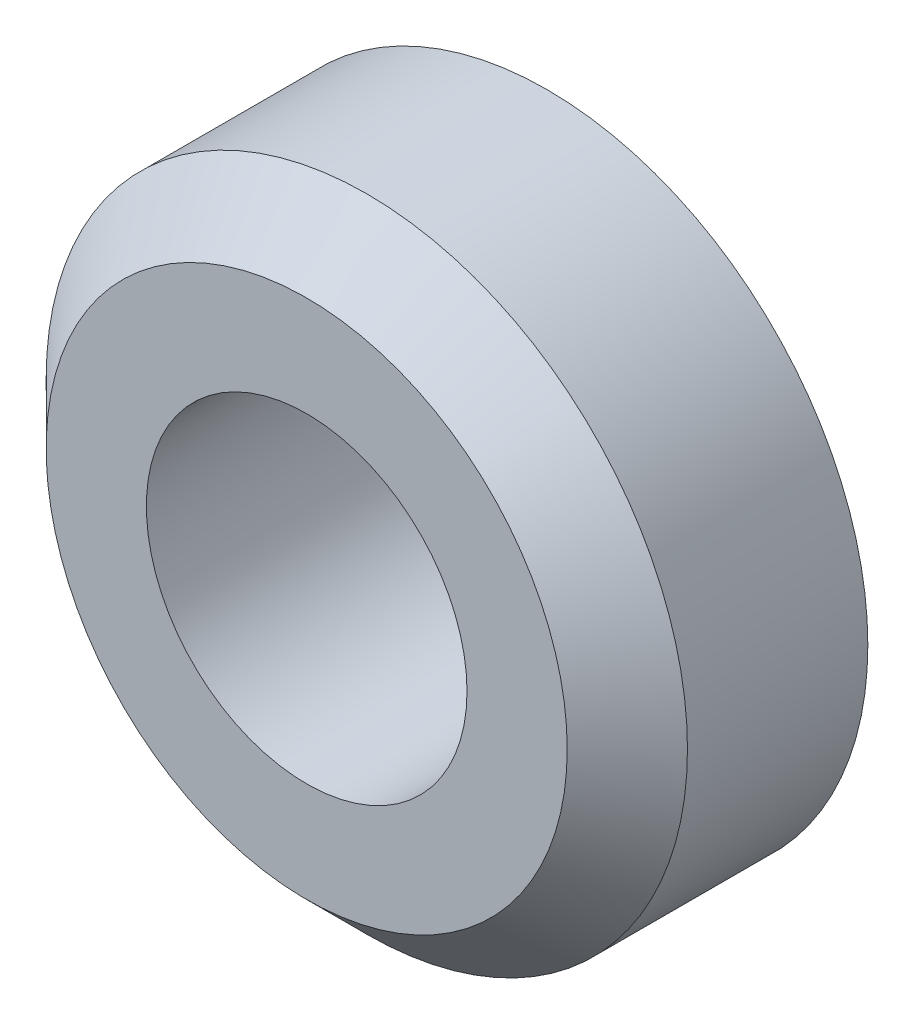
from build123d import *

# Parameters (mm, degrees)
SCHIZZO1_R                   = 8
SCHIZZO1_R_2                 = 4
ESTRUSIONE_ESTRUSIONE1_DEPTH = 6
SMUSSO1_SIZE                 = 1.5


with BuildPart() as part:
    # Schizzo1 → Estrusione-Estrusione1 (new body)
    with BuildSketch(Plane.XY):
        Circle(SCHIZZO1_R)
        Circle(SCHIZZO1_R_2, mode=Mode.SUBTRACT)
    extrude(amount=ESTRUSIONE_ESTRUSIONE1_DEPTH)

    # Smusso1
    smusso1_edges = [part.edges().sort_by_distance(p)[0] for p in [
        (-8, 0, 6),
    ]]
    chamfer(smusso1_edges, length=SMUSSO1_SIZE)


solid = part.part
